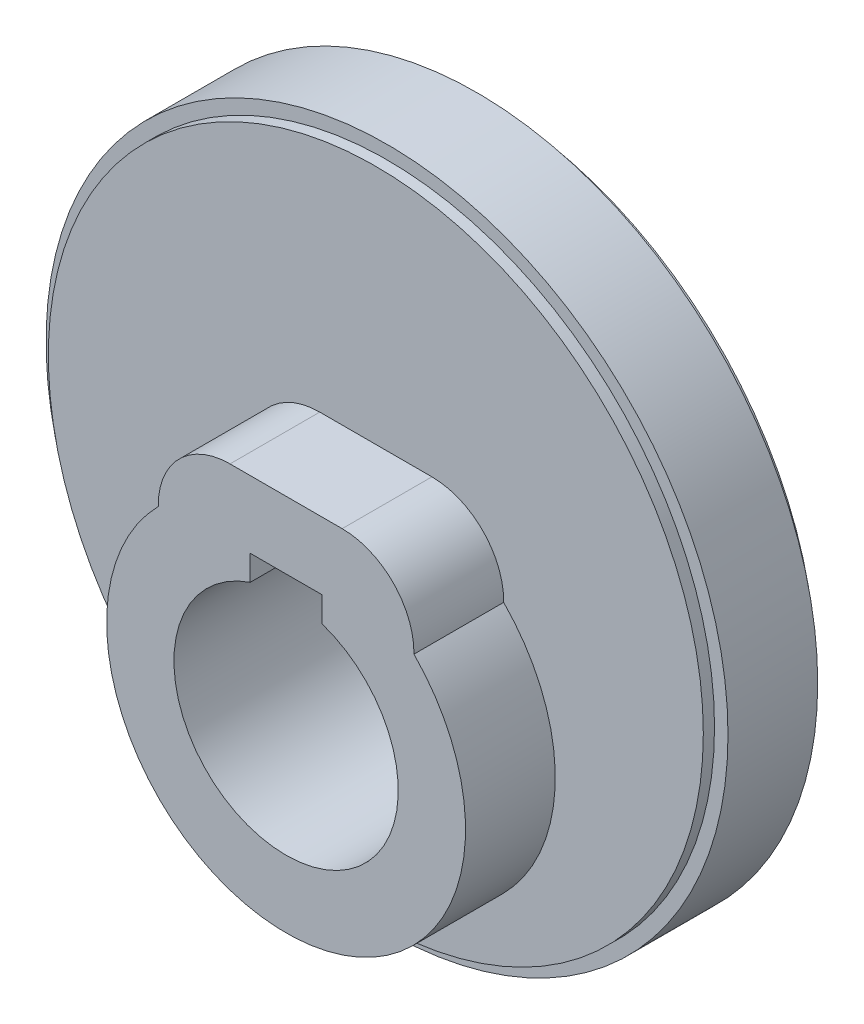
from build123d import *

# Parameters (mm, degrees)
SKETCH1_R           = 73
BOSS_EXTRUDE1_DEPTH = 25
BOSS_EXTRUDE2_START = 2.5
SKETCH1_3_R         = 76
SKETCH1_3_R_2       = 73
BOSS_EXTRUDE2_DEPTH = 20
BOSS_EXTRUDE3_DEPTH = 45
CUT_EXTRUDE1_DEPTH  = 10


with BuildPart() as part:
    # Sketch1 → Boss-Extrude1 (new body)
    with BuildSketch(Plane.XY):
        Circle(SKETCH1_R)
        with BuildLine():
            ThreePointArc((-28.498326366, 3.06858376), (-23.895232771, 14.5315925), (-12.5, 19.3))
            Line((-12.5, 19.3), (12.5, 19.3))
            ThreePointArc((12.5, 19.3), (23.895232771, 14.5315925), (28.498326366, 3.06858376))
            ThreePointArc((28.498326366, 3.06858376), (0, -65), (-28.498326366, 3.06858376))
        make_face(mode=Mode.SUBTRACT)
    extrude(amount=BOSS_EXTRUDE1_DEPTH)

    # Sketch1<3> → Boss-Extrude2 (add)
    with BuildSketch(Plane.XY.offset(BOSS_EXTRUDE2_START)):
        Circle(SKETCH1_3_R)
        Circle(SKETCH1_3_R_2, mode=Mode.SUBTRACT)
    extrude(amount=BOSS_EXTRUDE2_DEPTH)

    # Sketch1<4> → Boss-Extrude3 (add)
    with BuildSketch(Plane.XY):
        with BuildLine():
            Line((12.5, 19.3), (-12.5, 19.3))
            ThreePointArc((-12.5, 19.3), (-23.895232771, 14.5315925), (-28.498326366, 3.06858376))
            ThreePointArc((-28.498326366, 3.06858376), (0, -65), (28.498326366, 3.06858376))
            ThreePointArc((28.498326366, 3.06858376), (23.895232771, 14.5315925), (12.5, 19.3))
        make_face()
        with BuildLine():
            Line((-8, -1.314561435), (-8, 4.3))
            Line((-8, 4.3), (8, 4.3))
            Line((8, 4.3), (8, -1.314561435))
            ThreePointArc((8, -1.314561435), (0, -50), (-8, -1.314561435))
        make_face(mode=Mode.SUBTRACT)
    extrude(amount=BOSS_EXTRUDE3_DEPTH)

    # Sketch1<5> → Cut-Extrude1 (cut)
    with BuildSketch(Plane.XY):
        with BuildLine():
            ThreePointArc((16.394230769, 52.49980188), (13.722739792, 52.053064023), (12.5, 49.636176323))
            Line((12.5, 49.636176323), (12.5, 30.890517979))
            ThreePointArc((12.5, 30.890517979), (13.111991163, 29.074639736), (14.698275862, 27.999629118))
            ThreePointArc((14.698275862, 27.999629118), (35.057623034, 17.378804457), (49.305876787, -0.629310345))
            ThreePointArc((49.305876787, -0.629310345), (52.697492054, -2.21666073), (54.995016416, 0.740384615))
            ThreePointArc((54.995016416, 0.740384615), (44.089289769, 32.880610208), (16.394230769, 52.49980188))
        make_face()
        with BuildLine():
            Line((-12.5, 30.890517979), (-12.5, 49.636176323))
            ThreePointArc((-12.5, 49.636176323), (-13.722739792, 52.053064023), (-16.394230769, 52.49980188))
            ThreePointArc((-16.394230769, 52.49980188), (-44.089289769, 32.880610208), (-54.995016416, 0.740384615))
            ThreePointArc((-54.995016416, 0.740384615), (-52.697492054, -2.21666073), (-49.305876787, -0.629310345))
            ThreePointArc((-49.305876787, -0.629310345), (-35.057623034, 17.378804457), (-14.698275862, 27.999629118))
            ThreePointArc((-14.698275862, 27.999629118), (-13.111991163, 29.074639736), (-12.5, 30.890517979))
        make_face()
    extrude(amount=CUT_EXTRUDE1_DEPTH, mode=Mode.SUBTRACT)


solid = part.part
